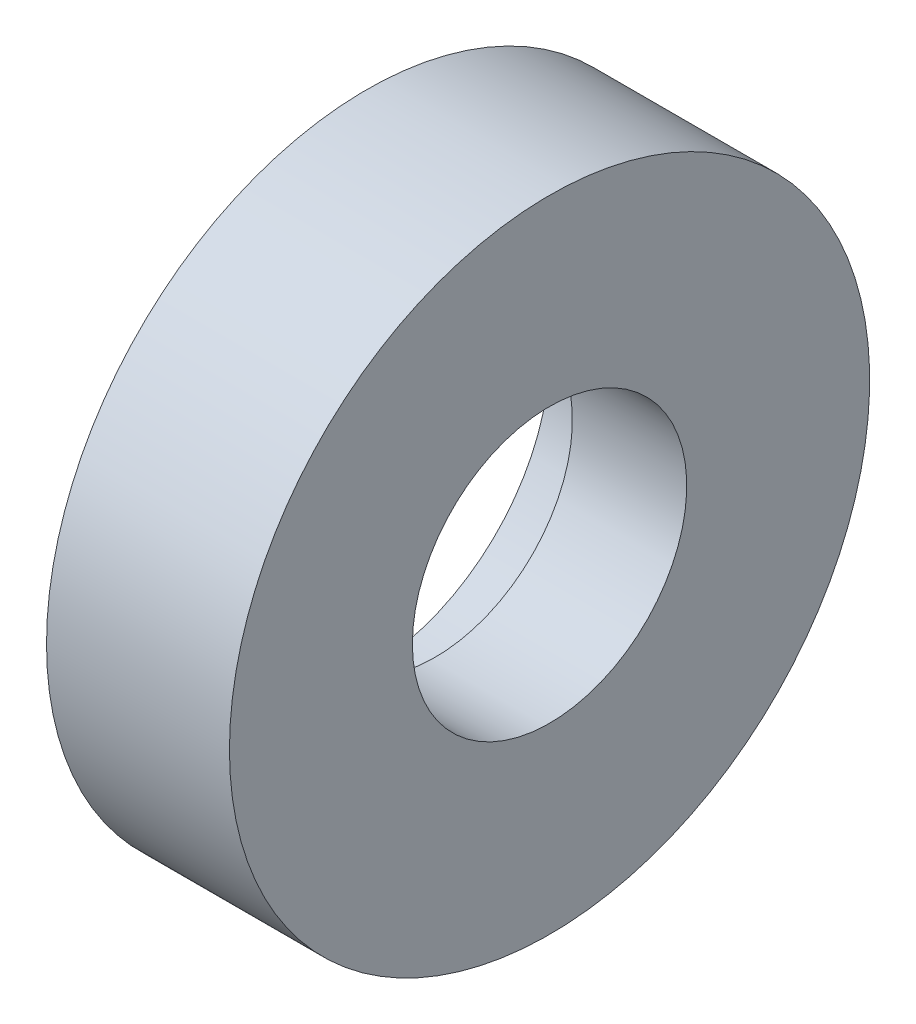
from build123d import *


with BuildPart() as part:
    # Sketch3 → Revolve1 (revolve)
    with BuildSketch(Plane(origin=(0, 0, 0), x_dir=(1, 0, 0), z_dir=(0, 1, 0)), mode=Mode.PRIVATE) as revolve1_sk:
        Polygon((8.588608185, 14), (8.588608185, 8), (11.588608185, 8), (11.588608185, 6), (16.588608185, 6), (16.588608185, 14), align=None)
    revolve(revolve1_sk.sketch.rotate(Axis((0, 0, 0), (1, 0, 0)), 180), axis=Axis((0, 0, 0), (1, 0, 0)))


solid = part.part
